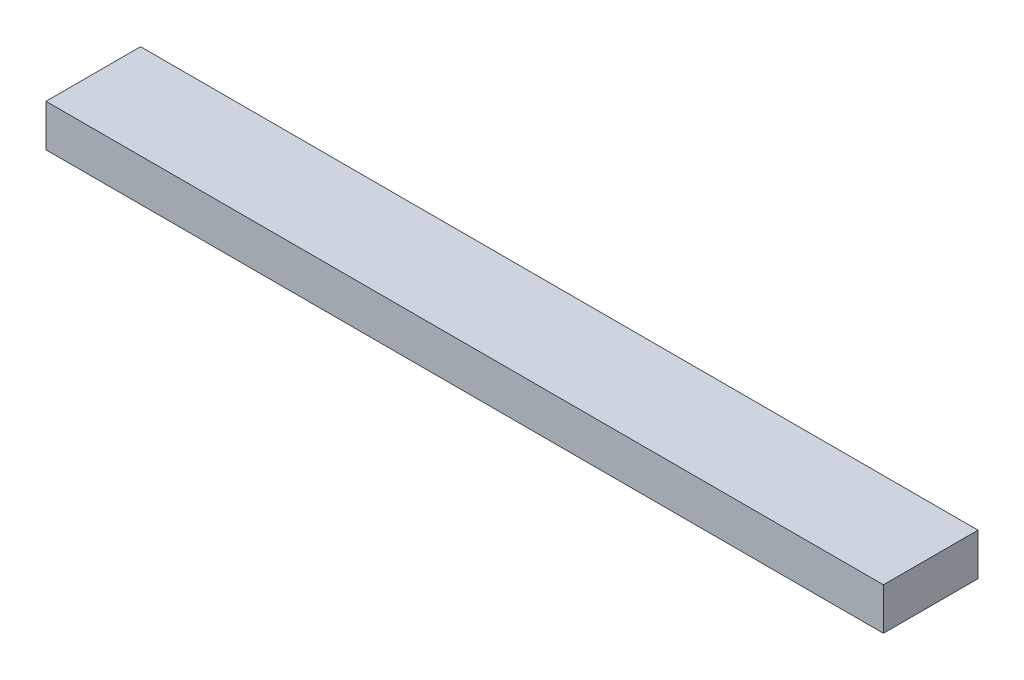
from build123d import *

# Parameters (mm, degrees)
SKETCH1_W           = 252.977532672
SKETCH1_H           = 12.7
BOSS_EXTRUDE1_DEPTH = 28.575
HOLE1_D             = 3.175
HOLE1_DEPTH         = 38.1
HOLE1_CSINK_D       = 10.16
HOLE1_CSINK_ANGLE   = 82
HOLE1_TIP           = 0.953866233


with BuildPart() as part:
    # Sketch1 → Boss-Extrude1 (new body)
    with BuildSketch(Plane.XY):
        with Locations((0, -304.8)):
            Rectangle(SKETCH1_W, SKETCH1_H)
    extrude(amount=BOSS_EXTRUDE1_DEPTH)

    # Hole1
    with Locations(Plane(origin=(0, 0, -25.4), x_dir=(-1, 0, 0), z_dir=(0, 0, -1))):
        with Locations((-75.688766336, -9.525), (218.563766336, -31.75), (218.563766336, -218.821), (218.563766336, -418.592), (104.263766336, -19.05), (104.263766336, -149.225), (104.263766336, -279.4), (120.138766336, -330.2), (120.138766336, -441.325), (-120.138766336, -441.325), (-120.138766336, -330.2), (-104.263766336, -279.4), (-104.263766336, -149.225), (-104.263766336, -19.05), (-218.563766336, -418.592), (-218.563766336, -218.821), (-218.563766336, -31.75), (0, -304.8), (107.438766336, -304.8), (-107.438766336, -304.8), (75.688766336, -276.225), (0, -276.225), (-75.688766336, -276.225), (75.688766336, -9.525), (0, -9.525)):
            CounterSinkHole(HOLE1_D / 2, HOLE1_CSINK_D / 2, depth=HOLE1_DEPTH, counter_sink_angle=HOLE1_CSINK_ANGLE)
            with Locations((0, 0, -(HOLE1_DEPTH + HOLE1_TIP / 2))):  # 118° drill point
                Cone(0, HOLE1_D / 2, HOLE1_TIP, mode=Mode.SUBTRACT)


solid = part.part
